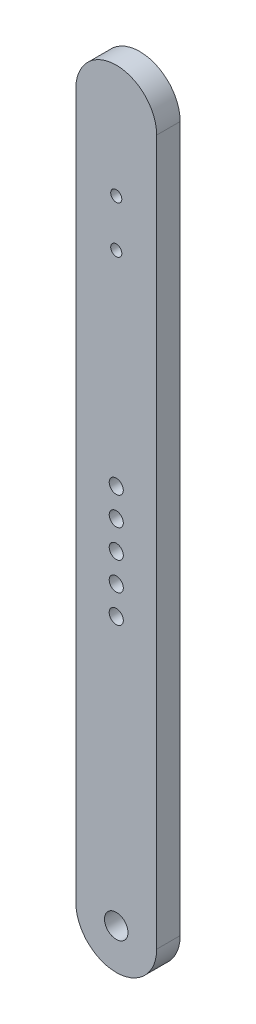
from build123d import *

# Parameters (mm, degrees)
SKETCH1_R           = 3.175
SKETCH1_R_2         = 1.905
SKETCH1_R_3         = 1.49987
BOSS_EXTRUDE1_DEPTH = 6.35


with BuildPart() as part:
    # Sketch1 → Boss-Extrude1 (new body)
    with BuildSketch(Plane.XY):
        with BuildLine():
            Line((-10.922, 0), (-10.922, 190.5))
            ThreePointArc((-10.922, 190.5), (0, 201.422), (10.922, 190.5))
            Line((10.922, 190.5), (10.922, 0))
            ThreePointArc((10.922, 0), (0, -10.922), (-10.922, 0))
        make_face()
        Circle(SKETCH1_R, mode=Mode.SUBTRACT)
        with Locations((0, 95.25)):
            Circle(SKETCH1_R_2, mode=Mode.SUBTRACT)
        with Locations((0, 87.63)):
            Circle(SKETCH1_R_2, mode=Mode.SUBTRACT)
        with Locations((0, 80.01)):
            Circle(SKETCH1_R_2, mode=Mode.SUBTRACT)
        with Locations((0, 72.39)):
            Circle(SKETCH1_R_2, mode=Mode.SUBTRACT)
        with Locations((0, 102.87)):
            Circle(SKETCH1_R_2, mode=Mode.SUBTRACT)
        with Locations((0, 170.789184136)):
            Circle(SKETCH1_R_3, mode=Mode.SUBTRACT)
        with Locations((0, 158.089184136)):
            Circle(SKETCH1_R_3, mode=Mode.SUBTRACT)
    extrude(amount=BOSS_EXTRUDE1_DEPTH)


solid = part.part
